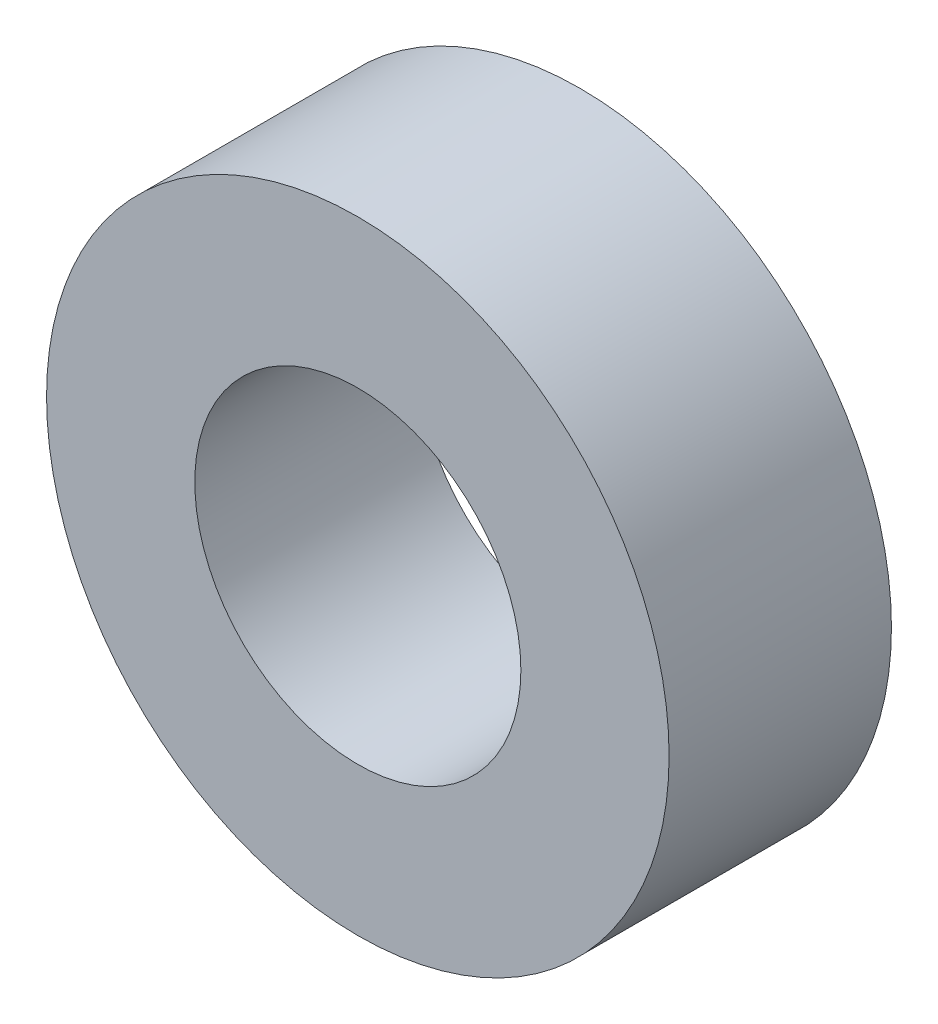
from build123d import *

# Parameters (mm, degrees)
SKETCH1_R           = 2.1
SKETCH1_R_2         = 1.1
BOSS_EXTRUDE1_DEPTH = 1.5


with BuildPart() as part:
    # Sketch1 → Boss-Extrude1 (new body)
    with BuildSketch(Plane.XY):
        Circle(SKETCH1_R)
        Circle(SKETCH1_R_2, mode=Mode.SUBTRACT)
    extrude(amount=BOSS_EXTRUDE1_DEPTH)


solid = part.part
